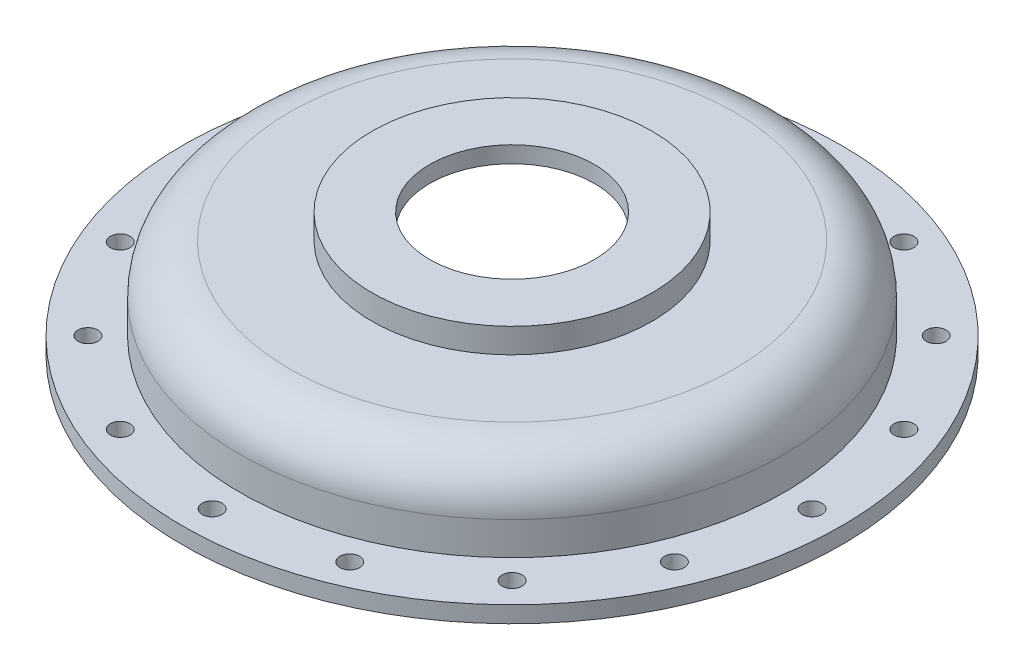
from build123d import *

# Parameters (mm, degrees)
SKETCH4_R          = 1270
CUT_EXTRUDE3_DEPTH = 7433.484443307
SKETCH5_R          = 152.4
CUT_EXTRUDE4_DEPTH = 7372.472105353
CIRPATTERN2_COUNT  = 16


with BuildPart() as part:
    # Sketch1 → Revolve2 (revolve)
    with BuildSketch(Plane.XY, mode=Mode.PRIVATE) as revolve2_sk:
        with BuildLine():
            Line((0, 1905), (2159, 1905))
            Line((2159, 1905), (2159, 1524))
            Line((2159, 1524), (3429, 1524))
            ThreePointArc((3429, 1524), (3967.815367264, 1300.815367264), (4191, 762))
            Line((4191, 762), (4191, 254))
            Line((4191, 254), (5080, 254))
            Line((5080, 254), (5080, 0))
            Line((5080, 0), (3937, 0))
            Line((3937, 0), (3937, 508))
            ThreePointArc((3937, 508), (3713.815367264, 1046.815367264), (3175, 1270))
            Line((3175, 1270), (1905, 1270))
            Line((1905, 1270), (1905, 1651))
            Line((1905, 1651), (0, 1651))
            Line((0, 1651), (0, 1905))
        make_face()
    revolve(revolve2_sk.sketch.rotate(Axis((0, 0, 0), (0, 1, 0)), 90), axis=Axis((0, 0, 0), (0, 1, 0)))

    # Sketch4 → Cut-Extrude3 (cut, through all)
    with BuildSketch(Plane(origin=(0, 1905, 0), x_dir=(1, 0, 0), z_dir=(0, 1, 0))):
        with Locations(Location((0, 0, 0), (0, 0, 270))):
            Circle(SKETCH4_R)
    extrude(amount=-CUT_EXTRUDE3_DEPTH, mode=Mode.SUBTRACT)

    # Sketch5 → Cut-Extrude4 (cut, through all)
    with BuildSketch(Plane(origin=(0, 254, 0), x_dir=(1, 0, 0), z_dir=(0, 1, 0))):
        with Locations(Location((0, 4622.8, 0), (0, 0, 270))):
            Circle(SKETCH5_R)
    cut_extrude4 = extrude(amount=-CUT_EXTRUDE4_DEPTH, mode=Mode.SUBTRACT)

    # CirPattern2: Cut-Extrude4 ×16 about axis
    cirpattern2_axis = Axis((0, 0, 0), (0, 1, 0))
    for i in range(1, CIRPATTERN2_COUNT):
        add(cut_extrude4.rotate(cirpattern2_axis, i * 360 / CIRPATTERN2_COUNT), mode=Mode.SUBTRACT)


solid = part.part
